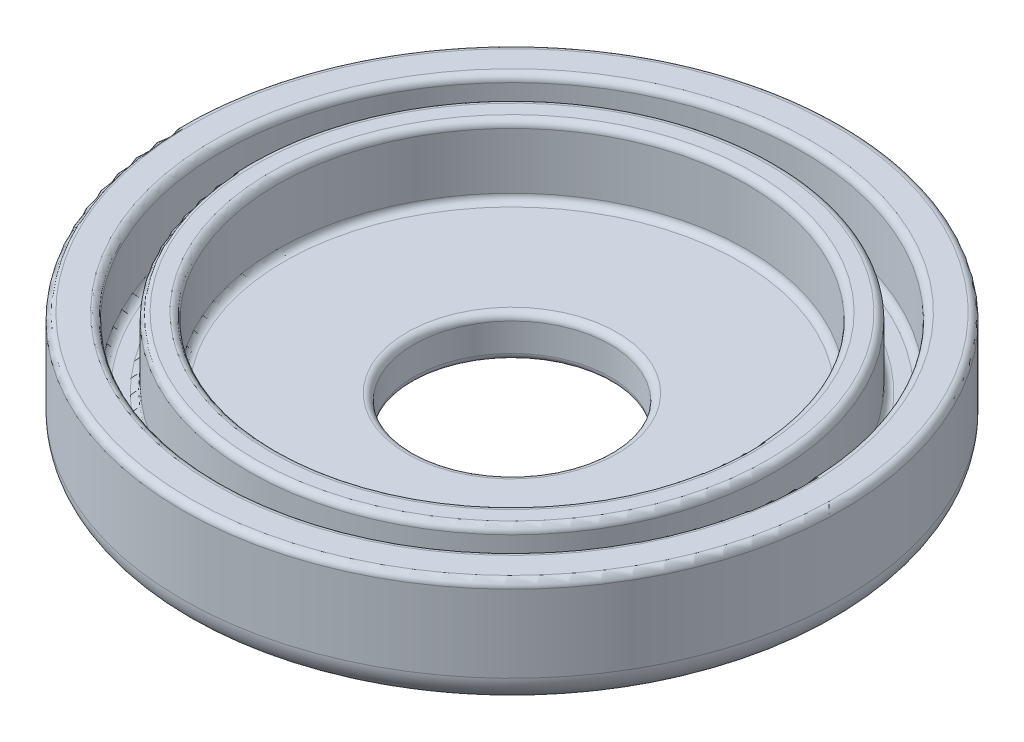
from build123d import *

# Parameters (mm, degrees)
SKETCH1_R           = 23.5
BOSS_EXTRUDE1_DEPTH = 8
SKETCH2_R           = 20.75
CUT_EXTRUDE1_DEPTH  = 5
SKETCH3_R           = 18.75
BOSS_EXTRUDE2_DEPTH = 5
SKETCH4_R           = 16.75
CUT_EXTRUDE2_DEPTH  = 5
SKETCH5_R           = 7
CUT_EXTRUDE3_DEPTH  = 5
FILLET2_R           = 0.5
FILLET3_R           = 2


with BuildPart() as part:
    # Sketch1 → Boss-Extrude1 (new body)
    with BuildSketch(Plane(origin=(0, 0, 0), x_dir=(1, 0, 0), z_dir=(0, 1, 0))):
        with Locations(Location((0, 0, 0), (0, 0, 270))):
            Circle(SKETCH1_R)
    extrude(amount=BOSS_EXTRUDE1_DEPTH)

    # Sketch2 → Cut-Extrude1 (cut)
    with BuildSketch(Plane(origin=(0, 8, 0), x_dir=(1, 0, 0), z_dir=(0, 1, 0))):
        with Locations(Location((0, 0, 0), (0, 0, 270))):
            Circle(SKETCH2_R)
    extrude(amount=-CUT_EXTRUDE1_DEPTH, mode=Mode.SUBTRACT)

    # Sketch3 → Boss-Extrude2 (add)
    with BuildSketch(Plane(origin=(0, 3, 0), x_dir=(1, 0, 0), z_dir=(0, 1, 0))):
        with Locations(Location((0, 0, 0), (0, 0, 270))):
            Circle(SKETCH3_R)
    extrude(amount=BOSS_EXTRUDE2_DEPTH)

    # Sketch4 → Cut-Extrude2 (cut)
    with BuildSketch(Plane(origin=(0, 8, 0), x_dir=(1, 0, 0), z_dir=(0, 1, 0))):
        with Locations(Location((0, 0, 0), (0, 0, 270))):
            Circle(SKETCH4_R)
    extrude(amount=-CUT_EXTRUDE2_DEPTH, mode=Mode.SUBTRACT)

    # Sketch5 → Cut-Extrude3 (cut)
    with BuildSketch(Plane(origin=(0, 3, 0), x_dir=(1, 0, 0), z_dir=(0, 1, 0))):
        with Locations(Location((0, 0, 0), (0, 0, 270))):
            Circle(SKETCH5_R)
    extrude(amount=-CUT_EXTRUDE3_DEPTH, mode=Mode.SUBTRACT)

    # Fillet2
    fillet2_edges = [part.edges().sort_by_distance(p)[0] for p in [
        (0, 8, -23.5),
        (0, 0, -7),
        (0, 8, -20.75),
        (0, 3, -7),
        (0, 3, -20.75),
        (0, 3, -16.75),
        (0, 3, -18.75),
        (0, 8, -16.75),
        (0, 8, -18.75),
    ]]
    fillet(fillet2_edges, radius=FILLET2_R)

    # Fillet3
    fillet3_edges = [part.edges().sort_by_distance(p)[0] for p in [
        (0, 0, -23.5),
    ]]
    fillet(fillet3_edges, radius=FILLET3_R)


solid = part.part
